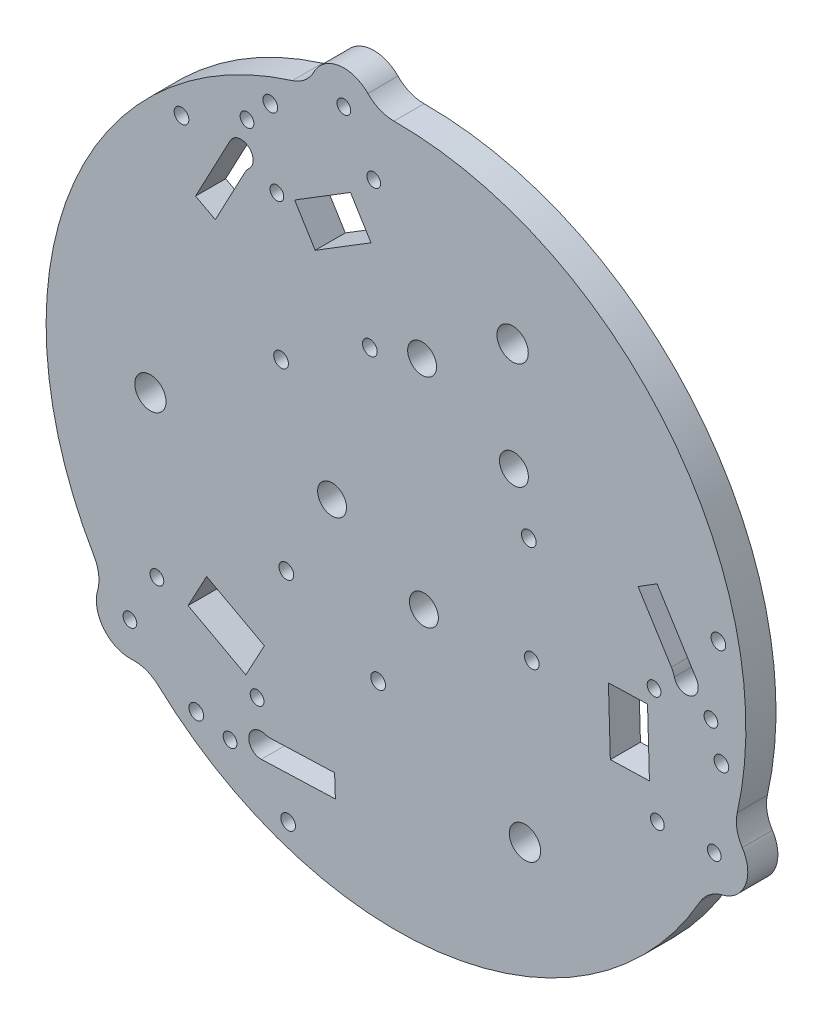
from build123d import *

# Parameters (mm, degrees)
MODEL_R             = 1.45
MODEL_R_2           = 1.55
MODEL_R_3           = 3.3
MODEL_R_4           = 3.048
BOSS_EXTRUDE1_DEPTH = 6.35


with BuildPart() as part:
    # Model → Boss-Extrude1 (new body)
    with BuildSketch(Plane.XY):
        with BuildLine():
            ThreePointArc((71.963132539, -16.30426092), (71.896606956, -19.345127891), (73.024752162, -22.169766979))
            ThreePointArc((73.024752162, -22.169766979), (73.705673151, -28.611226497), (68.857053859, -32.906217194))
            ThreePointArc((68.857053859, -32.906217194), (66.118599711, -34.22991144), (64.11603721, -36.519243442))
            ThreePointArc((64.11603721, -36.519243442), (11.268864031, -72.921423961), (-50.101470416, -54.169770455))
            ThreePointArc((-50.101470416, -54.169770455), (-52.70167567, -52.591724124), (-55.71195748, -52.156406987))
            ThreePointArc((-55.71195748, -52.156406987), (-61.630885553, -49.525372103), (-62.92614696, -43.178849276))
            ThreePointArc((-62.92614696, -43.178849276), (-62.703272731, -40.145431292), (-63.684611152, -37.266495293))
            ThreePointArc((-63.684611152, -37.266495293), (-68.786237646, 26.701589457), (-21.861662123, 70.474031375))
            ThreePointArc((-21.861662123, 70.474031375), (-19.194931286, 71.936852015), (-17.312794682, 74.326173966))
            ThreePointArc((-17.312794682, 74.326173966), (-12.074787597, 78.1365986), (-5.930906899, 76.08506647))
            ThreePointArc((-5.930906899, 76.08506647), (-3.41532698, 74.375342732), (-0.431426057, 73.785738734))
            ThreePointArc((-0.431426057, 73.785738734), (57.517373614, 46.219834503), (71.963132539, -16.30426092))
        make_face()
        with Locations((-10.994529329, 71.146189371)):
            Circle(MODEL_R, mode=Mode.SUBTRACT)
        with Locations((-56.117142713, -45.094636387)):
            Circle(MODEL_R, mode=Mode.SUBTRACT)
        with Locations((-4.695418168, 60.932414429)):
            Circle(MODEL_R, mode=Mode.SUBTRACT)
        with Locations((-31.422079216, 58.547967052)):
            Circle(MODEL_R, mode=Mode.SUBTRACT)
        with Locations((-25.122968055, 48.33419211)):
            Circle(MODEL_R, mode=Mode.SUBTRACT)
        with Locations((-50.421309724, -34.532558628)):
            Circle(MODEL_R, mode=Mode.SUBTRACT)
        with Locations((-34.9929872, -56.486302366)):
            Circle(MODEL_R, mode=Mode.SUBTRACT)
        with Locations((-29.29715421, -45.924224608)):
            Circle(MODEL_R, mode=Mode.SUBTRACT)
        with Locations((67.111672043, -26.051552984)):
            Circle(MODEL_R, mode=Mode.SUBTRACT)
        with Locations((-24.235417087, 18.341485339)):
            Circle(MODEL_R_2, mode=Mode.SUBTRACT)
        with Locations((-5.510157235, 29.889859367)):
            Circle(MODEL_R_2, mode=Mode.SUBTRACT)
        with Locations((-26.507192439, 63.935772611)):
            Circle(MODEL_R_2, mode=Mode.SUBTRACT)
        with Locations((-45.232452291, 52.387398583)):
            Circle(MODEL_R_2, mode=Mode.SUBTRACT)
        with Locations((-22.752591866, -65.366152049)):
            Circle(MODEL_R_2, mode=Mode.SUBTRACT)
        with Locations((-42.116407073, -54.923788341)):
            Circle(MODEL_R_2, mode=Mode.SUBTRACT)
        with Locations((-3.766483704, -30.159229537)):
            Circle(MODEL_R_2, mode=Mode.SUBTRACT)
        with Locations((-23.130298911, -19.716865827)):
            Circle(MODEL_R_2, mode=Mode.SUBTRACT)
        with Locations((28.001900788, 11.817744198)):
            Circle(MODEL_R_2, mode=Mode.SUBTRACT)
        with Locations((28.640456145, -10.17299354)):
            Circle(MODEL_R_2, mode=Mode.SUBTRACT)
        with Locations((68.623599511, -9.01198427)):
            Circle(MODEL_R_2, mode=Mode.SUBTRACT)
        with Locations((67.985044157, 12.978753468)):
            Circle(MODEL_R_2, mode=Mode.SUBTRACT)
        with Locations((27.199561986, -44.103080206)):
            Circle(MODEL_R_3, mode=Mode.SUBTRACT)
        with Locations((24.594606851, 45.607051755)):
            Circle(MODEL_R_3, mode=Mode.SUBTRACT)
        with Locations((-51.794168837, -1.503971549)):
            Circle(MODEL_R_3, mode=Mode.SUBTRACT)
        with Locations((-13.480814628, -1.823331492)):
            Circle(MODEL_R_4, mode=Mode.SUBTRACT)
        with Locations((5.883000578, -12.265695202)):
            Circle(MODEL_R_4, mode=Mode.SUBTRACT)
        with Locations((24.86910874, 22.94122731)):
            Circle(MODEL_R_4, mode=Mode.SUBTRACT)
        with Locations((5.505293533, 33.38359102)):
            Circle(MODEL_R_4, mode=Mode.SUBTRACT)
        with Locations((54.420122264, -2.409967499)):
            Circle(MODEL_R, mode=Mode.SUBTRACT)
        with Locations((66.415066415, -2.061664685)):
            Circle(MODEL_R, mode=Mode.SUBTRACT)
        with Locations((55.116727894, -26.399855798)):
            Circle(MODEL_R, mode=Mode.SUBTRACT)
        with BuildLine():
            Line((-34.947891278, 52.97654312), (-42.273098177, 39.165528758))
            Line((-42.273098177, 39.165528758), (-38.099417944, 36.951855639))
            Line((-38.099417944, 36.951855639), (-31.90308597, 48.634478542))
            ThreePointArc((-31.90308597, 48.634478542), (-31.465095291, 49.320977327), (-30.923040746, 49.928672388))
            ThreePointArc((-30.923040746, 49.928672388), (-31.145027643, 53.816962234), (-34.947891278, 52.97654312))
        make_face(mode=Mode.SUBTRACT)
        with BuildLine():
            Line((63.352977787, 3.777490095), (55.054891945, 17.02681254))
            Line((55.054891945, 17.02681254), (51.050954672, 14.519135991))
            Line((51.050954672, 14.519135991), (58.070236902, 3.311643638))
            ThreePointArc((58.070236902, 3.311643638), (58.44576695, 2.589083191), (58.701019038, 1.815802654))
            ThreePointArc((58.701019038, 1.815802654), (62.179370269, 0.06390403), (63.352977787, 3.777490095))
        make_face(mode=Mode.SUBTRACT)
        with BuildLine():
            Line((-28.40508651, -56.754033215), (-12.781793768, -56.192341298))
            Line((-12.781793768, -56.192341298), (-12.951536728, -51.47099163))
            Line((-12.951536728, -51.47099163), (-26.167150935, -51.946122181))
            ThreePointArc((-26.167150935, -51.946122181), (-26.980671662, -51.910060518), (-27.777978294, -51.744475042))
            ThreePointArc((-27.777978294, -51.744475042), (-31.034342627, -53.880866258), (-28.40508651, -56.754033215))
        make_face(mode=Mode.SUBTRACT)
        Polygon((53.043356097, -5.945390314), (44.795552885, -6.184885641), (45.197066243, -20.012308543), (53.444869455, -19.772813215), align=None, mode=Mode.SUBTRACT)
        Polygon((-21.372819002, 48.909589039), (-17.041508358, 41.886529595), (-5.267365536, 49.147961813), (-9.598676177, 56.171021257), align=None, mode=Mode.SUBTRACT)
        Polygon((-31.670537096, -42.964198725), (-27.754044527, -35.701643953), (-39.929700707, -29.13565327), (-43.846193278, -36.398208042), align=None, mode=Mode.SUBTRACT)
    extrude(amount=BOSS_EXTRUDE1_DEPTH)


solid = part.part
